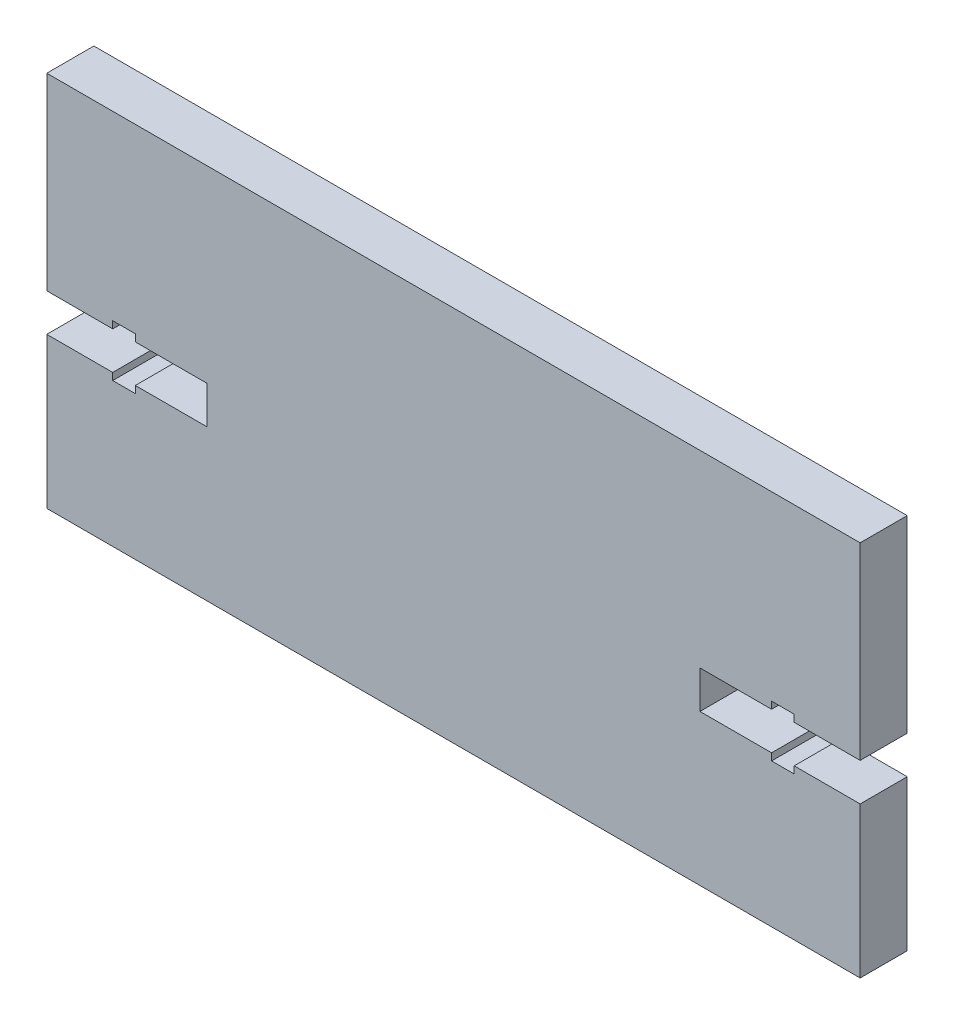
from build123d import *

# Parameters (mm, degrees)
SKETCH1_W           = 86.32648043
SKETCH1_H           = 40
BOSS_EXTRUDE1_DEPTH = 5
CUT_EXTRUDE1_DEPTH  = 10


with BuildPart() as part:
    # Sketch1 → Boss-Extrude1 (new body)
    with BuildSketch(Plane.XY):
        with Locations((8.444686318, -9.471450325)):
            Rectangle(SKETCH1_W, SKETCH1_H)
    extrude(amount=BOSS_EXTRUDE1_DEPTH)

    # Sketch2 → Cut-Extrude1 (cut)
    with BuildSketch(Plane(origin=(0, 0, 0), x_dir=(-1, 0, 0), z_dir=(0, 0, -1))):
        Polygon((-51.607926533, -9.471450325), (-44.607926533, -9.471450325), (-44.607926533, -8.721450325), (-42.207926533, -8.721450325), (-42.207926533, -9.471450325), (-34.607926533, -9.471450325), (-34.607926533, -13.471450325), (-42.207926533, -13.471450325), (-42.207926533, -14.221450325), (-44.607926533, -14.221450325), (-44.607926533, -13.471450325), (-51.607926533, -13.471450325), align=None)
        Polygon((34.718553897, -9.471450325), (34.718553897, -13.471450325), (27.718553897, -13.471450325), (27.718553897, -14.221450325), (25.318553897, -14.221450325), (25.318553897, -13.471450325), (17.718553897, -13.471450325), (17.718553897, -9.471450325), (25.318553897, -9.471450325), (25.318553897, -8.721450325), (27.718553897, -8.721450325), (27.718553897, -9.471450325), align=None)
    extrude(amount=-CUT_EXTRUDE1_DEPTH, mode=Mode.SUBTRACT)


solid = part.part
